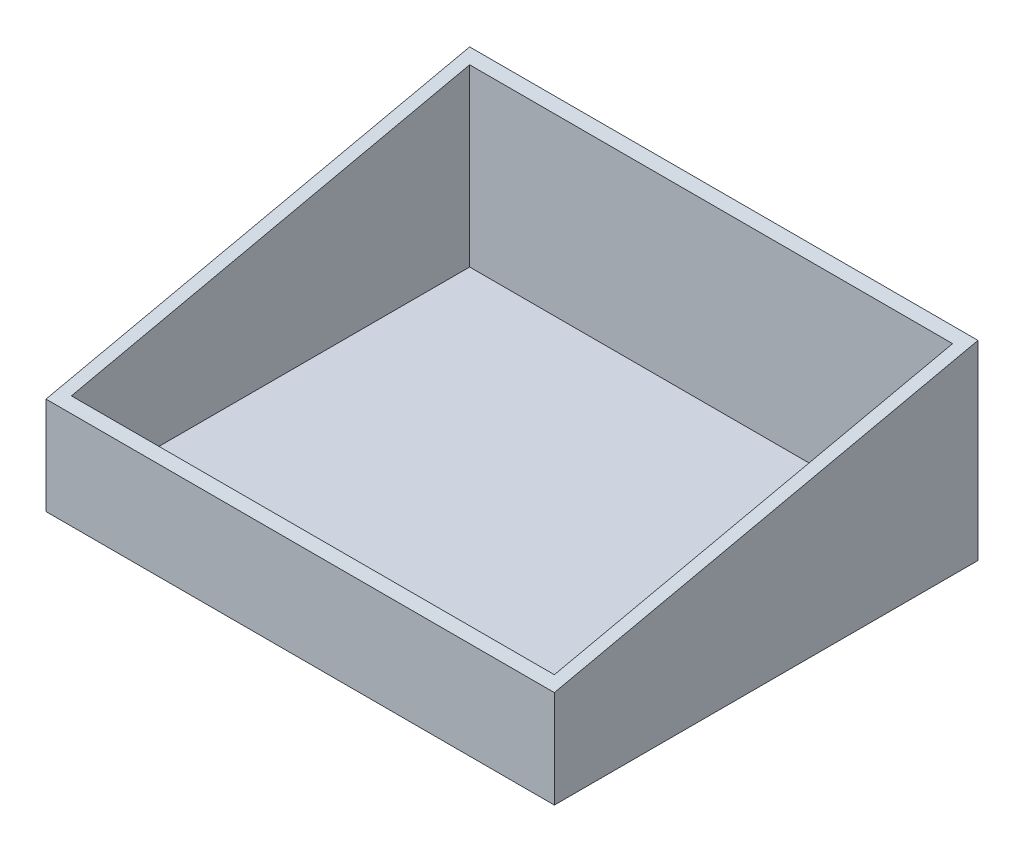
from build123d import *

# Parameters (mm, degrees)
SKETCH1_W               = 120
SKETCH1_H               = 100
BOSS_EXTRUDE1_DEPTH     = 45
CUT_EXTRUDE1_DEPTH      = 163.55768207
CUT_EXTRUDE1_DEPTH_BACK = 163.55768207
SHELL1_T                = -3


with BuildPart() as part:
    # Sketch1 → Boss-Extrude1 (new body)
    with BuildSketch(Plane(origin=(0, 0, 0), x_dir=(1, 0, 0), z_dir=(0, 1, 0))):
        with Locations((60, 50)):
            Rectangle(SKETCH1_W, SKETCH1_H)
    extrude(amount=BOSS_EXTRUDE1_DEPTH)

    # Sketch2 → Cut-Extrude1 (cut, two sides: drawn at the far end of the back side and taken through both)
    with BuildSketch(Plane(origin=(120, 0, 0), x_dir=(0, 0, -1), z_dir=(1, 0, 0)).offset(-CUT_EXTRUDE1_DEPTH_BACK)):
        Polygon((0, 23), (0, 45), (100, 45), align=None)
    extrude(amount=CUT_EXTRUDE1_DEPTH + CUT_EXTRUDE1_DEPTH_BACK, mode=Mode.SUBTRACT)

    # Shell1
    shell1_openings = [part.faces().sort_by_distance(p)[0] for p in [
        (60, 34, -50),
    ]]
    offset(amount=SHELL1_T, openings=shell1_openings, kind=Kind.INTERSECTION)


solid = part.part
